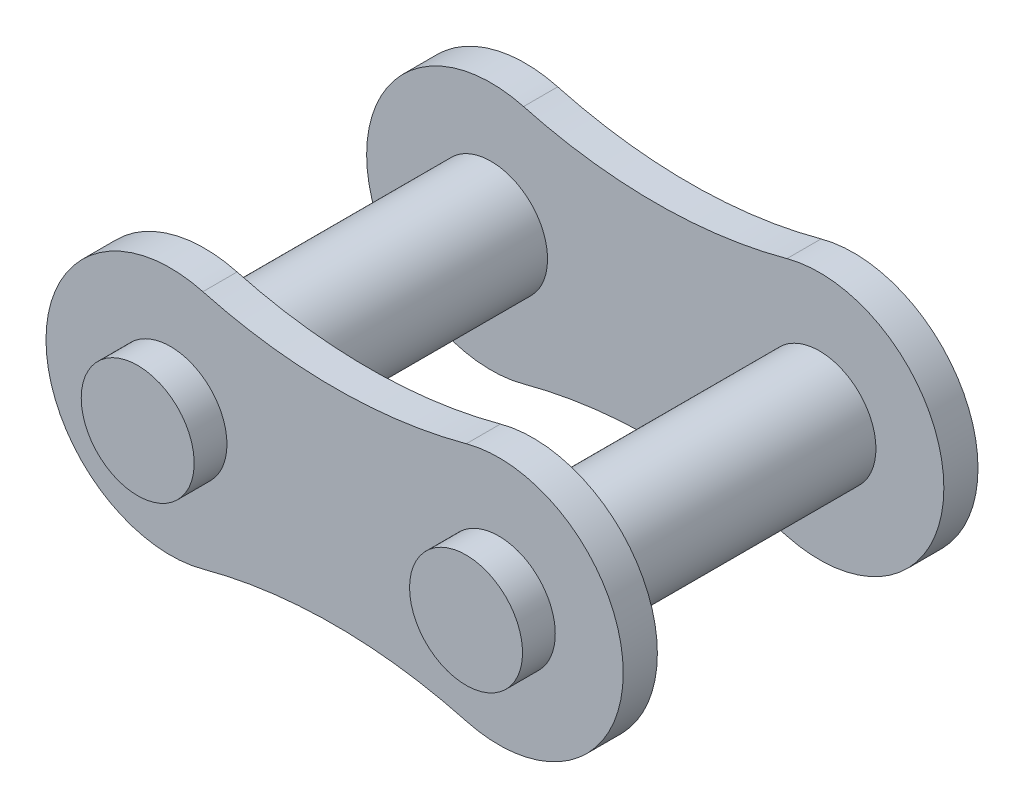
from build123d import *

# Parameters (mm, degrees)
SKETCH7_R                  = 1.6383
BOSS_EXTRUDE3_DEPTH        = 0.9906
BOSS_EXTRUDE4_DEPTH        = 6.096
BOSS_EXTRUDE4_DEPTH_BACK   = 6.096
SKETCH8_R                  = 1.6383
BOSS_EXTRUDE4_2_DEPTH      = 6.096
BOSS_EXTRUDE4_2_DEPTH_BACK = 6.096


with BuildPart() as part:
    # Sketch7 → Boss-Extrude3 (new body)
    with BuildSketch(Plane.XY.offset(-4.1554)):
        with BuildLine():
            ThreePointArc((5.704721623, 3.48471247), (1.152652, 0), (5.704721623, -3.48471247))
            ThreePointArc((5.704721623, -3.48471247), (9.525, -2.977345042), (13.345278377, -3.48471247))
            ThreePointArc((13.345278377, -3.48471247), (17.897348, 0), (13.345278377, 3.48471247))
            ThreePointArc((13.345278377, 3.48471247), (9.525, 2.977345042), (5.704721623, 3.48471247))
        make_face()
        with Locations((4.7625, 0)):
            Circle(SKETCH7_R, mode=Mode.SUBTRACT)
        with Locations((14.2875, 0)):
            Circle(SKETCH7_R, mode=Mode.SUBTRACT)
    extrude(amount=-BOSS_EXTRUDE3_DEPTH)


with BuildPart() as body_2:
    # Mirror1: mirrored copy
    add(part.part.mirror(Plane.XY))


with BuildPart() as body_3:
    # Sketch8 → Boss-Extrude4 (new, two sides: drawn at the far end of the back side and taken through both)
    with BuildSketch(Plane.XY.offset(-BOSS_EXTRUDE4_DEPTH_BACK)):
        with Locations(Location((4.7625, 0, 0), (0, 0, 180))):
            Circle(SKETCH8_R)
    extrude(amount=BOSS_EXTRUDE4_DEPTH + BOSS_EXTRUDE4_DEPTH_BACK)


with BuildPart() as body_4:
    # Sketch8 → Boss-Extrude4 2 (new, two sides: drawn at the far end of the back side and taken through both)
    with BuildSketch(Plane.XY.offset(-BOSS_EXTRUDE4_2_DEPTH_BACK)):
        with Locations(Location((14.2875, 0, 0), (0, 0, 180))):
            Circle(SKETCH8_R)
    extrude(amount=BOSS_EXTRUDE4_2_DEPTH + BOSS_EXTRUDE4_2_DEPTH_BACK)


solid = Compound([part.part, body_2.part, body_3.part, body_4.part])
